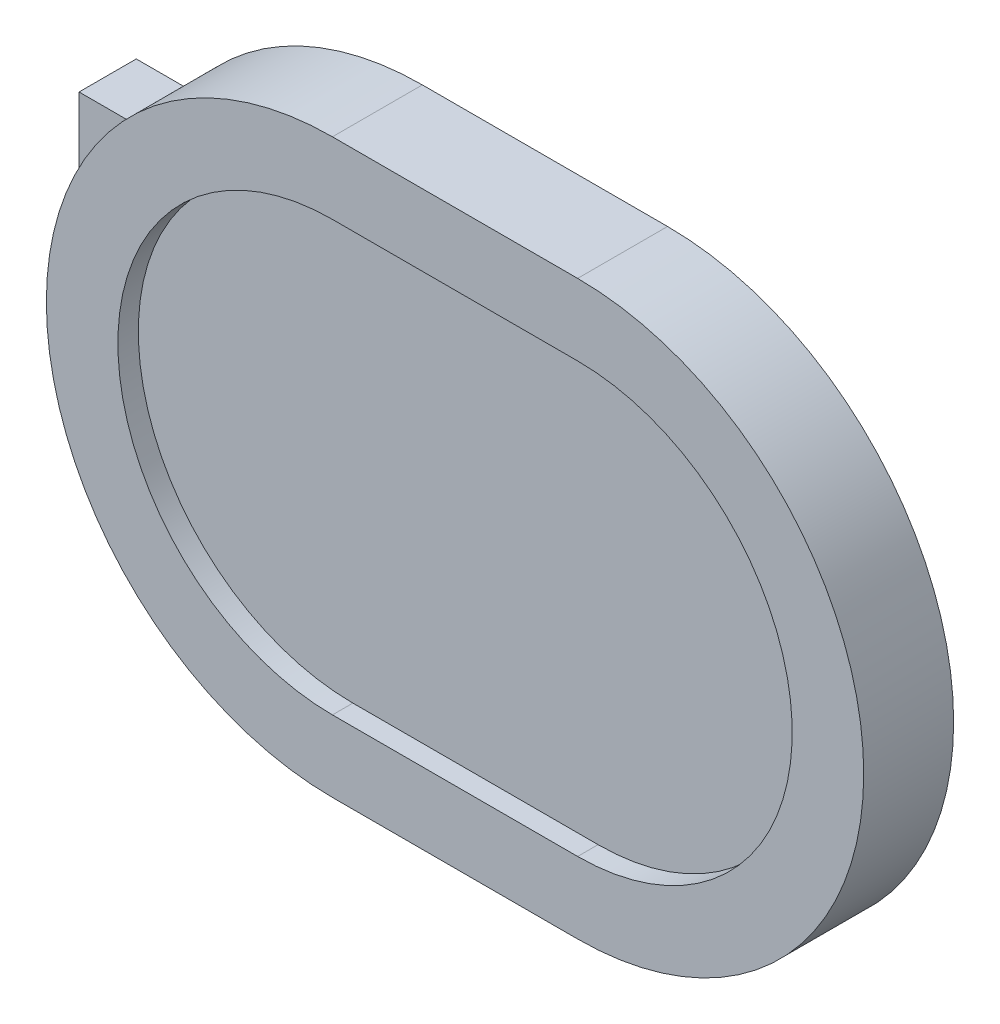
from build123d import *

# Parameters (mm, degrees)
SKETCH_1_R          = 5.3
EXTRUDE_1_DEPTH     = 0.8
EXTRUDE_2_DEPTH     = 2.2
CUT_EXTRUDE_1_DEPTH = 0.5
SKETCH_5_W          = 1.290577963
SKETCH_5_H          = 8.1
EXTRUDE_5_DEPTH     = 1.4
SKETCH_4_W          = 2.5
SKETCH_4_H          = 2.5
EXTRUDE_4_DEPTH     = 0.2


with BuildPart() as part:
    # Эскиз1 → Бобышка-Вытянуть1 (new body)
    with BuildSketch(Plane.XY):
        Circle(SKETCH_1_R)
    extrude(amount=EXTRUDE_1_DEPTH)

    # Эскиз2 → Бобышка-Вытянуть2 (add)
    with BuildSketch(Plane.XY.offset(0.8)):
        with BuildLine():
            Line((3, -7), (-3, -7))
            ThreePointArc((-3, -7), (-10, 0), (-3, 7))
            Line((-3, 7), (3, 7))
            ThreePointArc((3, 7), (10, 0), (3, -7))
        make_face()
    extrude(amount=EXTRUDE_2_DEPTH)

    # Эскиз3 → Вырез-Вытянуть1 (cut)
    with BuildSketch(Plane.XY.offset(3)):
        with BuildLine():
            Line((-3, 5.25), (3, 5.25))
            ThreePointArc((3, 5.25), (8.25, 0), (3, -5.25))
            Line((3, -5.25), (-3, -5.25))
            ThreePointArc((-3, -5.25), (-8.25, 0), (-3, 5.25))
        make_face()
    extrude(amount=-CUT_EXTRUDE_1_DEPTH, mode=Mode.SUBTRACT)

    # Эскиз5 → Бобышка-Вытянуть5 (add)
    with BuildSketch(Plane(origin=(0, 0, 0.8), x_dir=(-1, 0, 0), z_dir=(0, 0, -1))):
        with Locations((9.354711019, 0)):
            Rectangle(SKETCH_5_W, SKETCH_5_H)
    extrude(amount=-EXTRUDE_5_DEPTH)

    # Эскиз4 → Бобышка-Вытянуть4 (add)
    with BuildSketch(Plane(origin=(0, 0, 0.8), x_dir=(-1, 0, 0), z_dir=(0, 0, -1))):
        with Locations((8.45, 2.5)):
            Rectangle(SKETCH_4_W, SKETCH_4_H)
        with Locations((8.45, -2.5)):
            Rectangle(SKETCH_4_W, SKETCH_4_H)
    extrude(amount=EXTRUDE_4_DEPTH)


solid = part.part
